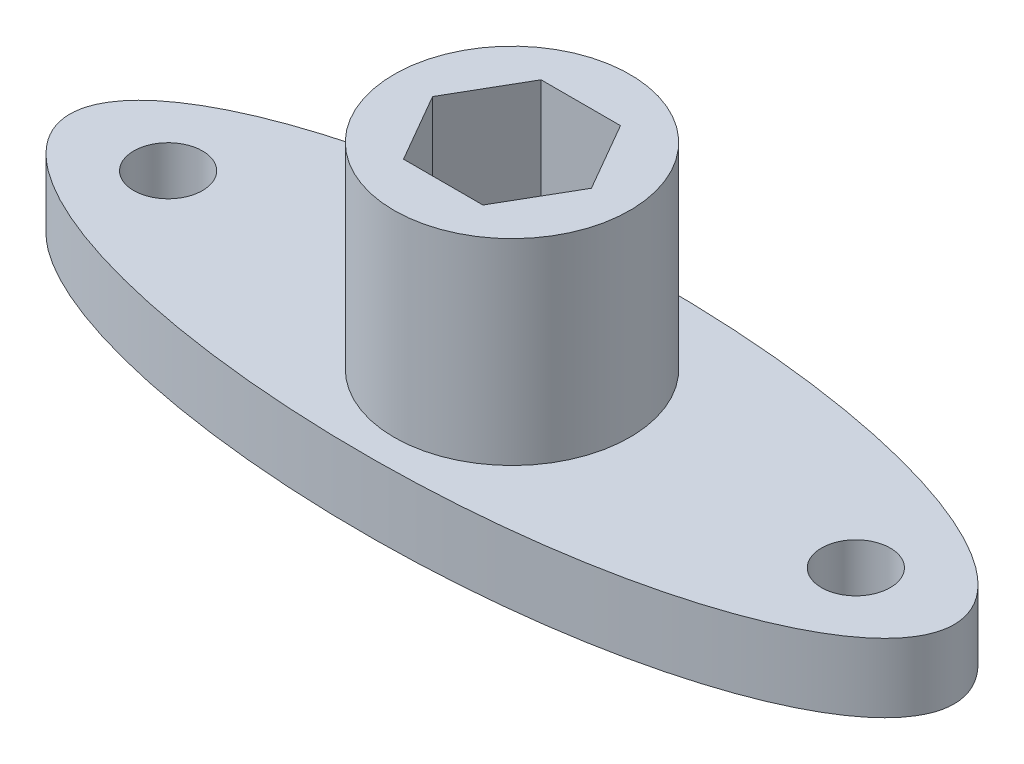
from build123d import *

# Parameters (mm, degrees)
SKETCH2_RX          = 22.5
SKETCH2_RY          = 7.5
SKETCH2_R           = 1.75
BOSS_EXTRUDE3_DEPTH = 3.5
SKETCH3_R           = 6
BOSS_EXTRUDE4_DEPTH = 10
CUT_EXTRUDE1_DEPTH  = 6.5


with BuildPart() as part:
    # Sketch2 → Boss-Extrude3 (new body)
    with BuildSketch(Plane(origin=(0, 0, 0), x_dir=(1, 0, 0), z_dir=(0, 1, 0))):
        with Locations((0, 0)):
            Ellipse(SKETCH2_RX, SKETCH2_RY)
        with Locations(Location((17.5, 0, 0), (0, 0, 270))):
            Circle(SKETCH2_R, mode=Mode.SUBTRACT)
        with Locations(Location((-17.5, 0, 0), (0, 0, 90))):
            Circle(SKETCH2_R, mode=Mode.SUBTRACT)
    extrude(amount=BOSS_EXTRUDE3_DEPTH)

    # Sketch3 → Boss-Extrude4 (add)
    with BuildSketch(Plane(origin=(0, 3.5, 0), x_dir=(1, 0, 0), z_dir=(0, 1, 0))):
        with Locations(Location((0, 0, 0), (0, 0, 270))):
            Circle(SKETCH3_R)
    extrude(amount=BOSS_EXTRUDE4_DEPTH)

    # Sketch4 → Cut-Extrude1 (cut)
    with BuildSketch(Plane(origin=(0, 13.5, 0), x_dir=(1, 0, 0), z_dir=(0, 1, 0))):
        Polygon((2.020725942, -3.5), (4.041451884, 0), (2.020725942, 3.5), (-2.020725942, 3.5), (-4.041451884, 0), (-2.020725942, -3.5), align=None)
    extrude(amount=-CUT_EXTRUDE1_DEPTH, mode=Mode.SUBTRACT)


solid = part.part
